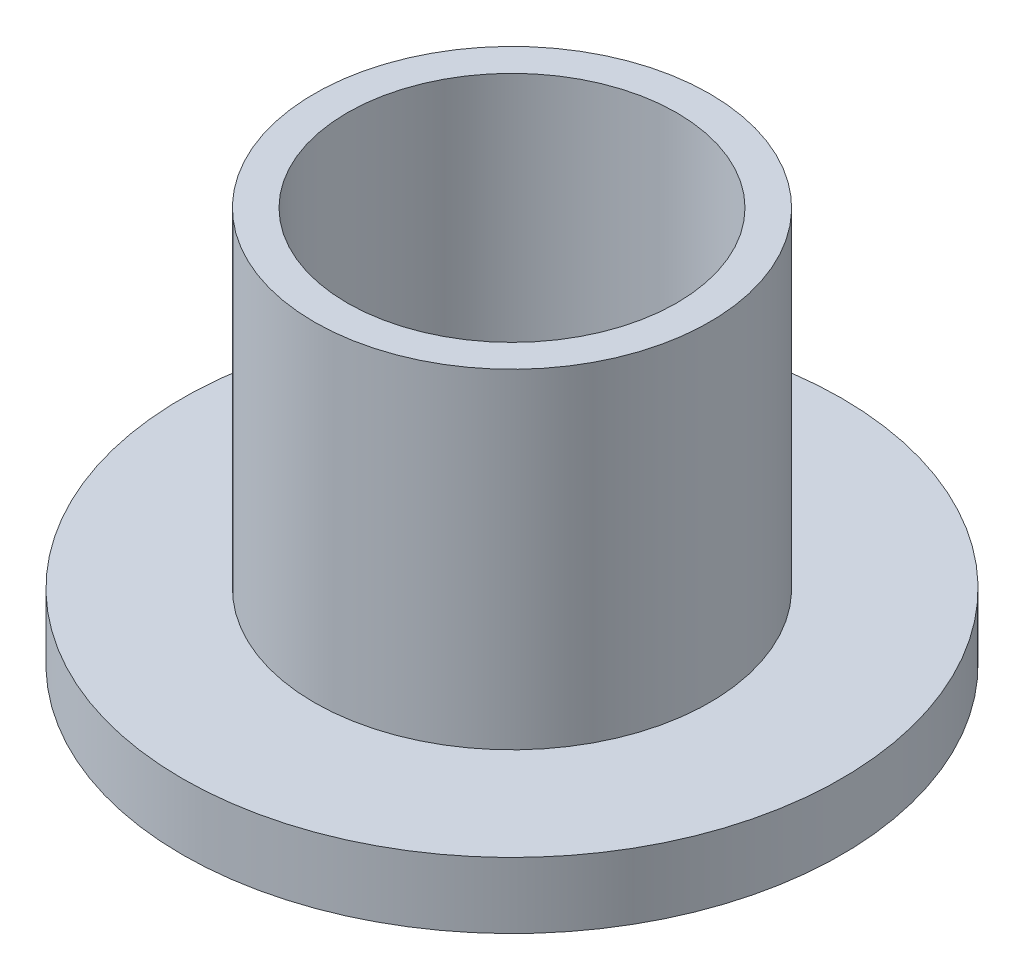
from build123d import *


with BuildPart() as part:
    # 草图1 → 旋转1 (revolve)
    with BuildSketch(Plane.XY, mode=Mode.PRIVATE) as revolve_1_sk:
        Polygon((2.5, 0), (2.5, 6), (3, 6), (3, 1), (5, 1), (5, 0), align=None)
    revolve(revolve_1_sk.sketch.rotate(Axis((0, 0, 0), (0, 1, 0)), 90), axis=Axis((0, 0, 0), (0, 1, 0)))


solid = part.part
